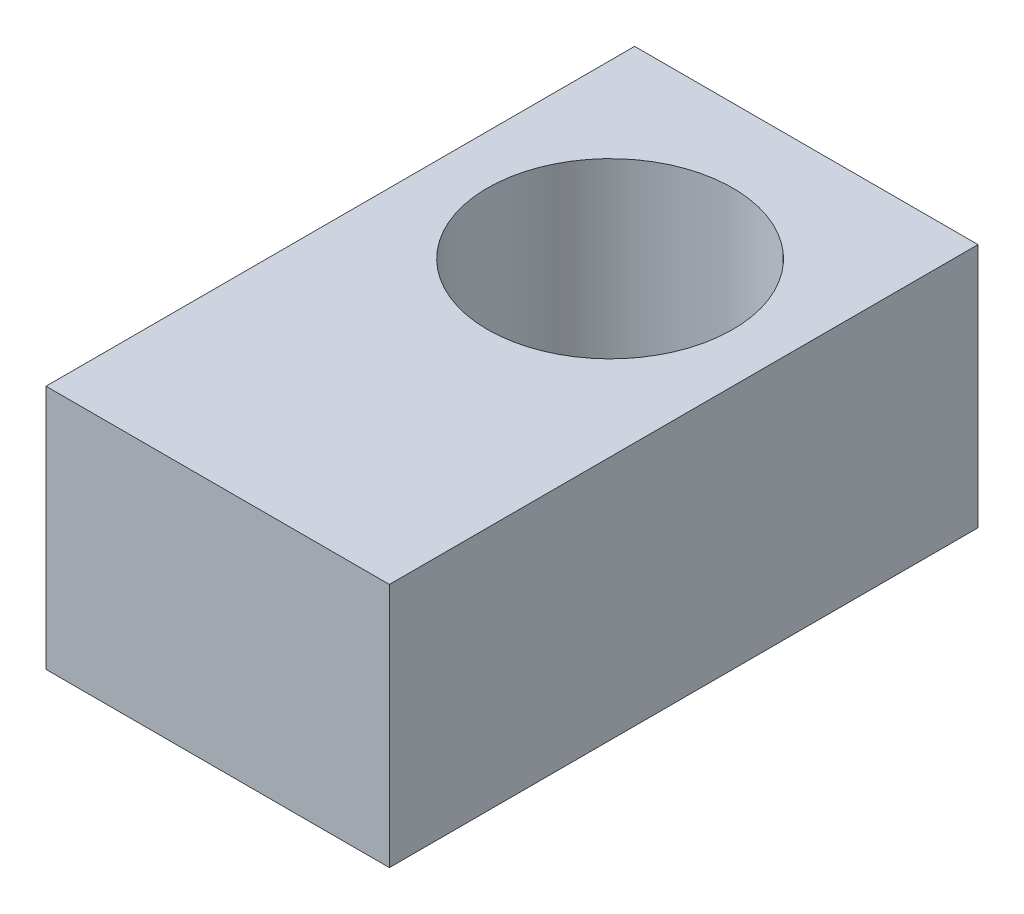
from build123d import *

# Parameters (mm, degrees)
SKETCH1_W           = 7
SKETCH1_H           = 12
BOSS_EXTRUDE1_DEPTH = 5
CUT_EXTRUDE1_REACH  = 10.559
SKETCH2_R           = 2.5


with BuildPart() as part:
    # Sketch1 → Boss-Extrude1 (new body)
    with BuildSketch(Plane(origin=(0, 0, 0), x_dir=(1, 0, 0), z_dir=(0, 1, 0))):
        Rectangle(SKETCH1_W, SKETCH1_H)
    extrude(amount=BOSS_EXTRUDE1_DEPTH)

    # Sketch2 → Cut-Extrude1 (cut, up to next)
    with BuildSketch(Plane(origin=(0, 5, 0), x_dir=(1, 0, 0), z_dir=(0, 1, 0)), mode=Mode.PRIVATE) as cut_extrude1_sk1:
        with Locations(Location((0, 2, 0), (0, 0, 270))):
            Circle(SKETCH2_R)
    cut_extrude1_tool1 = extrude(cut_extrude1_sk1.sketch, amount=-CUT_EXTRUDE1_REACH, mode=Mode.PRIVATE) & part.part
    add(cut_extrude1_tool1.solids().sort_by_distance((0, 5, -2))[0], mode=Mode.SUBTRACT)


solid = part.part
